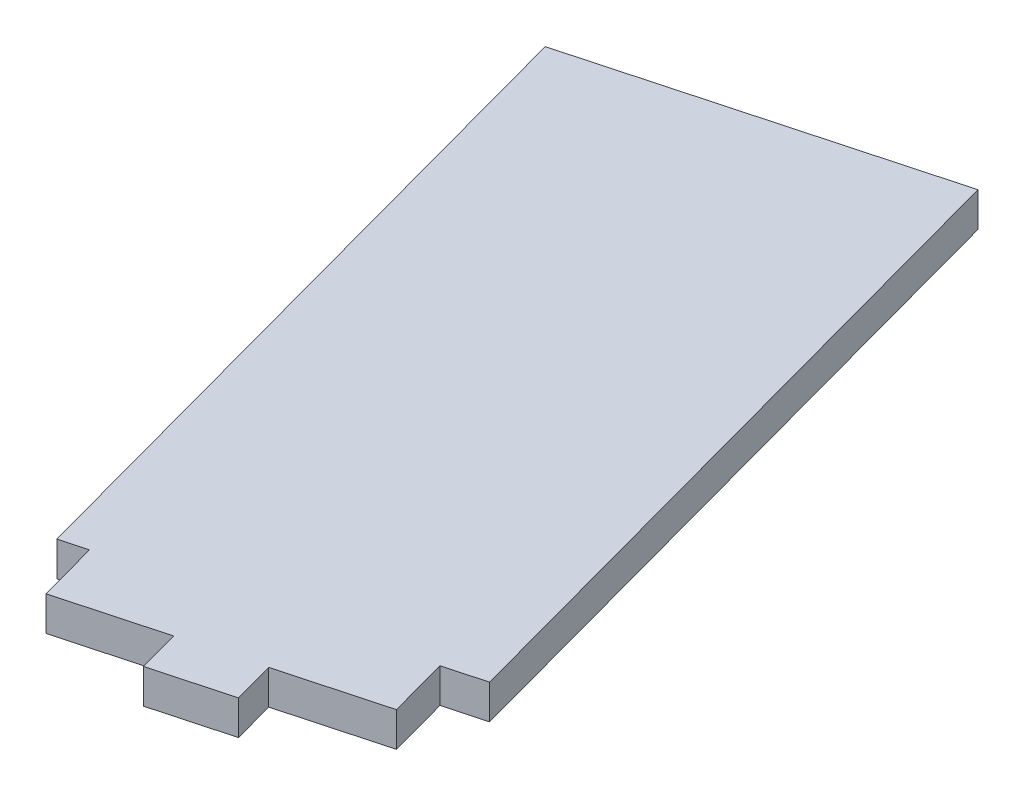
from build123d import *

# Parameters (mm, degrees)
BOSS_EXTRU_1_DEPTH = 2.54


with BuildPart() as part:
    # Esquisse1 → Boss.-Extru.1 (new body)
    with BuildSketch(Plane(origin=(0, 0, 0), x_dir=(1, 0, 0), z_dir=(0, 1, 0))):
        Polygon((-12.462012065, 31.963039537), (12.661838352, 38.790437667), (26.116808327, -10.721930959), (23.236757181, -11.504583915), (24.435714902, -15.916577159), (17.021115145, -17.931492217), (17.853724673, -20.995376415), (12.338733118, -22.494073565), (11.50612359, -19.430189368), (4.091523833, -21.445104426), (2.892566112, -17.033111182), (0.99295791, -17.54932909), align=None)
    extrude(amount=BOSS_EXTRU_1_DEPTH)


solid = part.part
